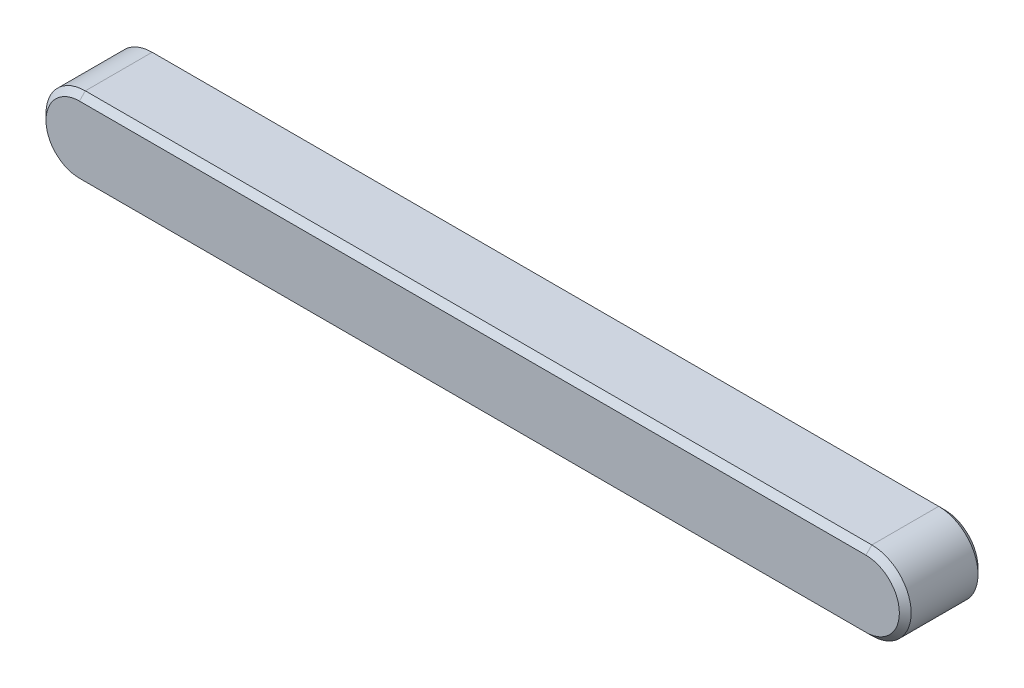
from build123d import *

# Parameters (mm, degrees)
EXTRUDE_1_DEPTH = 2
CHAMFER_1_SIZE  = 0.3


with BuildPart() as part:
    # 草图1 → 凸台-拉伸1 (new, symmetric)
    with BuildSketch(Plane.XY):
        with BuildLine():
            Line((-20, 2), (20, 2))
            ThreePointArc((20, 2), (22, 0), (20, -2))
            Line((20, -2), (-20, -2))
            ThreePointArc((-20, -2), (-22, 0), (-20, 2))
        make_face()
    extrude(amount=EXTRUDE_1_DEPTH, both=True)

    # 倒角1
    chamfer_1_edges = [part.edges().sort_by_distance(p)[0] for p in [
        (22, 0, 2),
        (0, 2, 2),
        (-22, 0, 2),
        (0, 2, -2),
        (22, 0, -2),
        (0, -2, -2),
        (-22, 0, -2),
        (0, -2, 2),
    ]]
    chamfer(chamfer_1_edges, length=CHAMFER_1_SIZE)


solid = part.part
